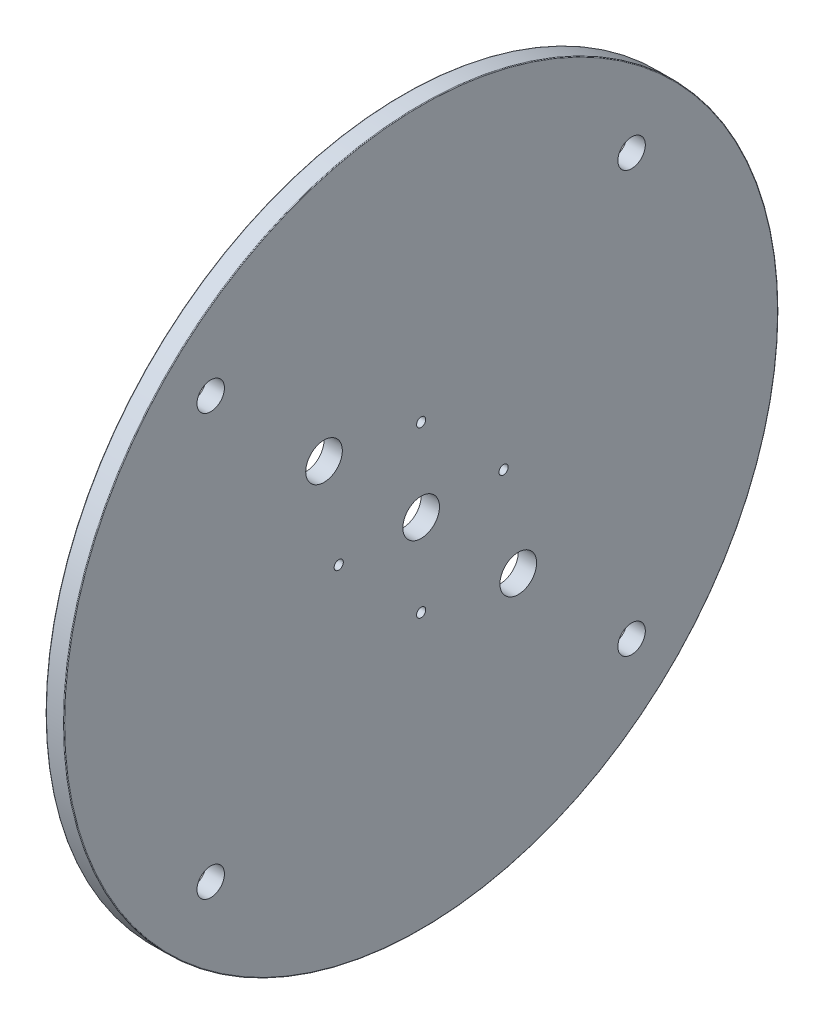
from build123d import *

# Parameters (mm, degrees)
SKETCH_1_R               = 156
EXTRUDE_1_DEPTH          = 8
SKETCH_4_R               = 6
CUT_EXTRUDE_3_DEPTH      = 10
PATTERN_CIRCULAR_2_COUNT = 4
FILLET_1_R               = 0.3
SKETCH_8_R               = 8
CUT_EXTRUDE_7_DEPTH      = 10
PATTERN_CIRCULAR_3_COUNT = 2
SKETCH_9_R               = 8
CUT_EXTRUDE_8_DEPTH      = 10
SKETCH_10_R              = 2
CUT_EXTRUDE_9_DEPTH      = 10
PATTERN_CIRCULAR_5_COUNT = 4


with BuildPart() as part:
    # 草图1 → 凸台-拉伸1 (new body)
    with BuildSketch(Plane(origin=(0, 0, 0), x_dir=(0, 0, -1), z_dir=(1, 0, 0))):
        Circle(SKETCH_1_R)
    extrude(amount=EXTRUDE_1_DEPTH)

    # 草图4 → 切除-拉伸3 (cut)
    with BuildSketch(Plane(origin=(8, 0, 0), x_dir=(0, 0, -1), z_dir=(1, 0, 0))):
        with Locations((91.923881554, 91.923881554)):
            Circle(SKETCH_4_R)
    cut_extrude_3 = extrude(amount=-CUT_EXTRUDE_3_DEPTH, mode=Mode.SUBTRACT)

    # 阵列(圆周)2: 切除-拉伸3 ×4 about axis
    pattern_circular_2_axis = Axis((0, 0, 0), (1, 0, 0))
    for i in range(1, PATTERN_CIRCULAR_2_COUNT):
        add(cut_extrude_3.rotate(pattern_circular_2_axis, i * 360 / PATTERN_CIRCULAR_2_COUNT), mode=Mode.SUBTRACT)

    # 圆角1
    fillet_1_edges = [part.edges().sort_by_distance(p)[0] for p in [
        (0, 0, 156),
        (8, 0, 156),
    ]]
    fillet(fillet_1_edges, radius=FILLET_1_R)

    # 草图8 → 切除-拉伸7 (cut)
    with BuildSketch(Plane(origin=(8, 0, 0), x_dir=(0, 0, -1), z_dir=(1, 0, 0))):
        with Locations((42.426406871, -42.426406871)):
            Circle(SKETCH_8_R)
    cut_extrude_7 = extrude(amount=-CUT_EXTRUDE_7_DEPTH, mode=Mode.SUBTRACT)

    # 阵列(圆周)3: 切除-拉伸7 ×2 about axis
    pattern_circular_3_axis = Axis((0, 0, 0), (1, 0, 0))
    for i in range(1, PATTERN_CIRCULAR_3_COUNT):
        add(cut_extrude_7.rotate(pattern_circular_3_axis, i * 360 / PATTERN_CIRCULAR_3_COUNT), mode=Mode.SUBTRACT)

    # 草图9 → 切除-拉伸8 (cut)
    with BuildSketch(Plane(origin=(8, 0, 0), x_dir=(0, 0, -1), z_dir=(1, 0, 0))):
        Circle(SKETCH_9_R)
    extrude(amount=-CUT_EXTRUDE_8_DEPTH, mode=Mode.SUBTRACT)

    # 草图10 → 切除-拉伸9 (cut)
    with BuildSketch(Plane(origin=(8, 0, 0), x_dir=(0, 0, -1), z_dir=(1, 0, 0))):
        with Locations((36, 0)):
            Circle(SKETCH_10_R)
    cut_extrude_9 = extrude(amount=-CUT_EXTRUDE_9_DEPTH, mode=Mode.SUBTRACT)

    # 阵列(圆周)5: 切除-拉伸9 ×4 about axis
    pattern_circular_5_axis = Axis((0, 0, 0), (1, 0, 0))
    for i in range(1, PATTERN_CIRCULAR_5_COUNT):
        add(cut_extrude_9.rotate(pattern_circular_5_axis, i * 360 / PATTERN_CIRCULAR_5_COUNT), mode=Mode.SUBTRACT)


solid = part.part
